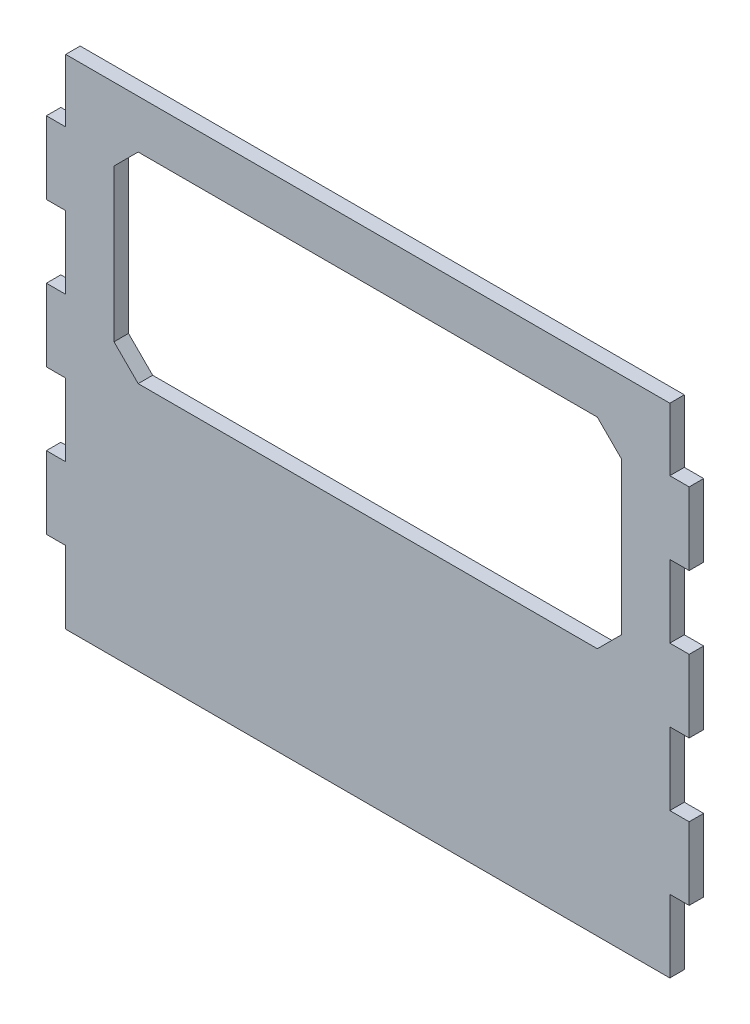
from build123d import *

# Parameters (mm, degrees)
SKETCH1_W           = 125
SKETCH1_H           = 103
BOSS_EXTRUDE1_DEPTH = 3
SKETCH2_W           = 4
SKETCH2_H           = 15
BOSS_EXTRUDE2_DEPTH = 3


with BuildPart() as part:
    # Sketch1 → Boss-Extrude1 (new body)
    with BuildSketch(Plane.XY):
        with Locations((-62.5, 51.5)):
            Rectangle(SKETCH1_W, SKETCH1_H)
        Polygon((-15, 93), (-110, 93), (-115, 88), (-115, 56.5), (-110, 51.5), (-15, 51.5), (-10, 56.5), (-10, 88), align=None, mode=Mode.SUBTRACT)
    extrude(amount=BOSS_EXTRUDE1_DEPTH)

    # Sketch2 → Boss-Extrude2 (add)
    with BuildSketch(Plane.XY.offset(3)):
        with Locations((2, 82.5)):
            Rectangle(SKETCH2_W, SKETCH2_H)
        with Locations((2, 22.5)):
            Rectangle(SKETCH2_W, SKETCH2_H)
        with Locations((-127, 22.5)):
            Rectangle(SKETCH2_W, SKETCH2_H)
        with Locations((2, 52.5)):
            Rectangle(SKETCH2_W, SKETCH2_H)
        with Locations((-127, 52.5)):
            Rectangle(SKETCH2_W, SKETCH2_H)
        with Locations((-127, 82.5)):
            Rectangle(SKETCH2_W, SKETCH2_H)
    extrude(amount=-BOSS_EXTRUDE2_DEPTH)


solid = part.part
